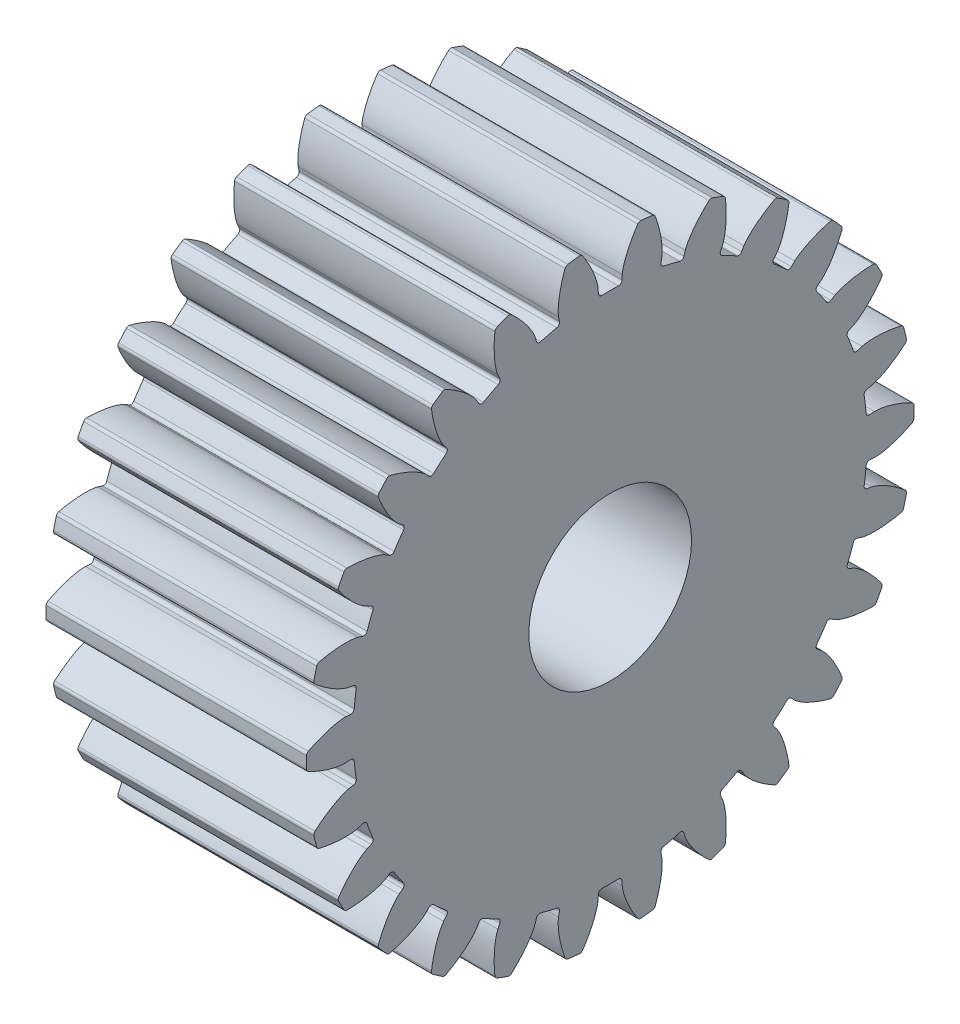
from build123d import *

# Parameters (mm, degrees)
SKETCH2_R                      = 14.816666667
SKETCH2_R_2                    = 3.96875
GEAR_WIDTH_EXTRUDE_DEPTH       = 12.7
GEAR_TOOTH_CUT_DEPTH           = 25.4
TOOTH_FILLETS_R                = 0.166158333
CIRPATTERN1_COUNT              = 26
CIRPATTERN1_COPY_1_DEPTH       = 25.4
CIRPATTERN1_COPY_2_DEPTH       = 25.4
CIRPATTERN1_COPY_3_DEPTH       = 25.4
CIRPATTERN1_COPY_4_DEPTH       = 25.4
CIRPATTERN1_COPY_5_DEPTH       = 25.4
CIRPATTERN1_COPY_6_DEPTH       = 25.4
CIRPATTERN1_COPY_7_DEPTH       = 25.4
CIRPATTERN1_COPY_8_DEPTH       = 25.4
CIRPATTERN1_COPY_9_DEPTH       = 25.4
CIRPATTERN1_COPY_10_DEPTH      = 25.4
CIRPATTERN1_COPY_11_DEPTH      = 25.4
CIRPATTERN1_COPY_12_DEPTH      = 25.4
CIRPATTERN1_COPY_13_DEPTH      = 25.4
CIRPATTERN1_COPY_14_DEPTH      = 25.4
CIRPATTERN1_COPY_15_DEPTH      = 25.4
CIRPATTERN1_COPY_16_DEPTH      = 25.4
CIRPATTERN1_COPY_17_DEPTH      = 25.4
CIRPATTERN1_COPY_18_DEPTH      = 25.4
CIRPATTERN1_COPY_19_DEPTH      = 25.4
CIRPATTERN1_COPY_20_DEPTH      = 25.4
CIRPATTERN1_COPY_21_DEPTH      = 25.4
CIRPATTERN1_COPY_22_DEPTH      = 25.4
CIRPATTERN1_COPY_23_DEPTH      = 25.4
CIRPATTERN1_COPY_24_DEPTH      = 25.4
CIRPATTERN1_COPY_25_DEPTH      = 25.4
TOOTH_FILLETS_OF_CIRPATTERN1_R = 0.166158333


with BuildPart() as part:
    # Sketch2 → Gear Width Extrude (new body)
    with BuildSketch(Plane.YZ):
        with Locations(Location((0, 0, 0), (0, 0, 270))):
            Circle(SKETCH2_R)
        with Locations(Location((0, 0, 0), (0, 0, 270))):
            Circle(SKETCH2_R_2, mode=Mode.SUBTRACT)
    extrude(amount=GEAR_WIDTH_EXTRUDE_DEPTH)

    # Sketch3 → Gear Tooth Cut (cut)
    with BuildSketch(Plane.YZ):
        with BuildLine():
            Line((12.533841667, 0), (14.816666667, 0))
            ThreePointArc((14.816666667, 0), (14.79996166, 0.70338182), (14.749884306, 1.405177589))
            add(Edge.make_bspline(
                [(12.915217508, 0.588188798), (12.918208341, 0.588360522), (12.926591, 0.5889519), (12.952440381, 0.591486174), (13.003294161, 0.598476616), (13.065845165, 0.609963216), (13.137508857, 0.625896967), (13.206422051, 0.64341803), (13.265177715, 0.659725839), (13.323624717, 0.677227502), (13.381691149, 0.695773656), (13.451831714, 0.719550719), (13.535655857, 0.749883796), (13.633192126, 0.787986968), (13.743267873, 0.834322472), (13.854828898, 0.884873112), (13.964077164, 0.937345481), (14.073810457, 0.993489939), (14.179521744, 1.050028375), (14.288612776, 1.111944092), (14.388950715, 1.17071875), (14.500534436, 1.240082235), (14.590344265, 1.297086613), (14.682395145, 1.358891943), (14.72708899, 1.389403312), (14.749884306, 1.405177589)],
                knots=[0, 0, 0, 0, 0, 0.005376749, 0.015083688, 0.04661014, 0.092110526, 0.119476176, 0.146842496, 0.174208854, 0.201574956, 0.228941013, 0.256307345, 0.307035032, 0.361767352, 0.416499661, 0.471231937, 0.525964282, 0.580696616, 0.635428982, 0.690161387, 0.744893688, 0.799626082, 0.854358407, 0.909090914, 0.909090914, 0.909090914, 0.909090914, 0.909090914], degree=4))
            Line((12.915217508, 0.588188798), (12.52086362, 0.570229012))
            ThreePointArc((12.52086362, 0.570229012), (12.530596735, 0.28518834), (12.533841667, 0))
        make_face()
    gear_tooth_cut = extrude(amount=GEAR_TOOTH_CUT_DEPTH, mode=Mode.SUBTRACT)

    # Gear Tooth Cut Mirror: Gear Tooth Cut across plane
    add(gear_tooth_cut.mirror(Plane(origin=(25.4, 0, 0), x_dir=(1, 0, 0), z_dir=(0, 0, 1))), mode=Mode.SUBTRACT)

    # Tooth Fillets
    tooth_fillets_edges = [part.edges().sort_by_distance(p)[0] for p in [
        (6.35, 14.749884306, 1.405177589),
        (6.35, 14.749884306, -1.405177589),
        (6.35, 12.52086362, 0.570229012),
        (6.35, 12.52086362, -0.570229012),
    ]]
    fillet(tooth_fillets_edges, radius=TOOTH_FILLETS_R)

    # CirPattern1: Gear Tooth Cut ×26 about axis
    cirpattern1_axis = Axis((0, 0, 0), (1, 0, 0))
    for i in range(1, CIRPATTERN1_COUNT):
        add(gear_tooth_cut.rotate(cirpattern1_axis, i * 360 / CIRPATTERN1_COUNT), mode=Mode.SUBTRACT)

    # CirPattern1 copy 1 sketch → CirPattern1 copy 1 (cut)
    with BuildSketch(Plane(origin=(0, 0, 0), x_dir=(0, 0.970941817426052, 0.23931566428755777), z_dir=(1, 0, 0))):
        with BuildLine():
            Line((12.533841667, 0), (14.816666667, 0))
            ThreePointArc((14.816666667, 0), (14.79996166, -0.70338182), (14.749884306, -1.405177589))
            add(Edge.make_bspline(
                [(12.915217508, -0.588188798), (12.918208341, -0.588360522), (12.926591, -0.5889519), (12.952440381, -0.591486174), (13.003294161, -0.598476616), (13.065845165, -0.609963216), (13.137508857, -0.625896967), (13.206422051, -0.64341803), (13.265177715, -0.659725839), (13.323624717, -0.677227502), (13.381691149, -0.695773656), (13.451831714, -0.719550719), (13.535655857, -0.749883796), (13.633192126, -0.787986968), (13.743267873, -0.834322472), (13.854828898, -0.884873112), (13.964077164, -0.937345481), (14.073810457, -0.993489939), (14.179521744, -1.050028375), (14.288612776, -1.111944092), (14.388950715, -1.17071875), (14.500534436, -1.240082235), (14.590344265, -1.297086613), (14.682395145, -1.358891943), (14.72708899, -1.389403312), (14.749884306, -1.405177589)],
                knots=[0, 0, 0, 0, 0, 0.005376749, 0.015083688, 0.04661014, 0.092110526, 0.119476176, 0.146842496, 0.174208854, 0.201574956, 0.228941013, 0.256307345, 0.307035032, 0.361767352, 0.416499661, 0.471231937, 0.525964282, 0.580696616, 0.635428982, 0.690161387, 0.744893688, 0.799626082, 0.854358407, 0.909090914, 0.909090914, 0.909090914, 0.909090914, 0.909090914], degree=4))
            Line((12.915217508, -0.588188798), (12.52086362, -0.570229012))
            ThreePointArc((12.52086362, -0.570229012), (12.530596735, -0.28518834), (12.533841667, 0))
        make_face()
    extrude(amount=CIRPATTERN1_COPY_1_DEPTH, mode=Mode.SUBTRACT)

    # CirPattern1 copy 2 sketch → CirPattern1 copy 2 (cut)
    with BuildSketch(Plane(origin=(0, 0, 0), x_dir=(0, 0.8854560256532099, 0.46472317204376856), z_dir=(1, 0, 0))):
        with BuildLine():
            Line((12.533841667, 0), (14.816666667, 0))
            ThreePointArc((14.816666667, 0), (14.79996166, -0.70338182), (14.749884306, -1.405177589))
            add(Edge.make_bspline(
                [(12.915217508, -0.588188798), (12.918208341, -0.588360522), (12.926591, -0.5889519), (12.952440381, -0.591486174), (13.003294161, -0.598476616), (13.065845165, -0.609963216), (13.137508857, -0.625896967), (13.206422051, -0.64341803), (13.265177715, -0.659725839), (13.323624717, -0.677227502), (13.381691149, -0.695773656), (13.451831714, -0.719550719), (13.535655857, -0.749883796), (13.633192126, -0.787986968), (13.743267873, -0.834322472), (13.854828898, -0.884873112), (13.964077164, -0.937345481), (14.073810457, -0.993489939), (14.179521744, -1.050028375), (14.288612776, -1.111944092), (14.388950715, -1.17071875), (14.500534436, -1.240082235), (14.590344265, -1.297086613), (14.682395145, -1.358891943), (14.72708899, -1.389403312), (14.749884306, -1.405177589)],
                knots=[0, 0, 0, 0, 0, 0.005376749, 0.015083688, 0.04661014, 0.092110526, 0.119476176, 0.146842496, 0.174208854, 0.201574956, 0.228941013, 0.256307345, 0.307035032, 0.361767352, 0.416499661, 0.471231937, 0.525964282, 0.580696616, 0.635428982, 0.690161387, 0.744893688, 0.799626082, 0.854358407, 0.909090914, 0.909090914, 0.909090914, 0.909090914, 0.909090914], degree=4))
            Line((12.915217508, -0.588188798), (12.52086362, -0.570229012))
            ThreePointArc((12.52086362, -0.570229012), (12.530596735, -0.28518834), (12.533841667, 0))
        make_face()
    extrude(amount=CIRPATTERN1_COPY_2_DEPTH, mode=Mode.SUBTRACT)

    # CirPattern1 copy 3 sketch → CirPattern1 copy 3 (cut)
    with BuildSketch(Plane(origin=(0, 0, 0), x_dir=(0, 0.7485107481711011, 0.6631226582407952), z_dir=(1, 0, 0))):
        with BuildLine():
            Line((12.533841667, 0), (14.816666667, 0))
            ThreePointArc((14.816666667, 0), (14.79996166, -0.70338182), (14.749884306, -1.405177589))
            add(Edge.make_bspline(
                [(12.915217508, -0.588188798), (12.918208341, -0.588360522), (12.926591, -0.5889519), (12.952440381, -0.591486174), (13.003294161, -0.598476616), (13.065845165, -0.609963216), (13.137508857, -0.625896967), (13.206422051, -0.64341803), (13.265177715, -0.659725839), (13.323624717, -0.677227502), (13.381691149, -0.695773656), (13.451831714, -0.719550719), (13.535655857, -0.749883796), (13.633192126, -0.787986968), (13.743267873, -0.834322472), (13.854828898, -0.884873112), (13.964077164, -0.937345481), (14.073810457, -0.993489939), (14.179521744, -1.050028375), (14.288612776, -1.111944092), (14.388950715, -1.17071875), (14.500534436, -1.240082235), (14.590344265, -1.297086613), (14.682395145, -1.358891943), (14.72708899, -1.389403312), (14.749884306, -1.405177589)],
                knots=[0, 0, 0, 0, 0, 0.005376749, 0.015083688, 0.04661014, 0.092110526, 0.119476176, 0.146842496, 0.174208854, 0.201574956, 0.228941013, 0.256307345, 0.307035032, 0.361767352, 0.416499661, 0.471231937, 0.525964282, 0.580696616, 0.635428982, 0.690161387, 0.744893688, 0.799626082, 0.854358407, 0.909090914, 0.909090914, 0.909090914, 0.909090914, 0.909090914], degree=4))
            Line((12.915217508, -0.588188798), (12.52086362, -0.570229012))
            ThreePointArc((12.52086362, -0.570229012), (12.530596735, -0.28518834), (12.533841667, 0))
        make_face()
    extrude(amount=CIRPATTERN1_COPY_3_DEPTH, mode=Mode.SUBTRACT)

    # CirPattern1 copy 4 sketch → CirPattern1 copy 4 (cut)
    with BuildSketch(Plane(origin=(0, 0, 0), x_dir=(0, 0.5680647467311558, 0.8229838658936565), z_dir=(1, 0, 0))):
        with BuildLine():
            Line((12.533841667, 0), (14.816666667, 0))
            ThreePointArc((14.816666667, 0), (14.79996166, -0.70338182), (14.749884306, -1.405177589))
            add(Edge.make_bspline(
                [(12.915217508, -0.588188798), (12.918208341, -0.588360522), (12.926591, -0.5889519), (12.952440381, -0.591486174), (13.003294161, -0.598476616), (13.065845165, -0.609963216), (13.137508857, -0.625896967), (13.206422051, -0.64341803), (13.265177715, -0.659725839), (13.323624717, -0.677227502), (13.381691149, -0.695773656), (13.451831714, -0.719550719), (13.535655857, -0.749883796), (13.633192126, -0.787986968), (13.743267873, -0.834322472), (13.854828898, -0.884873112), (13.964077164, -0.937345481), (14.073810457, -0.993489939), (14.179521744, -1.050028375), (14.288612776, -1.111944092), (14.388950715, -1.17071875), (14.500534436, -1.240082235), (14.590344265, -1.297086613), (14.682395145, -1.358891943), (14.72708899, -1.389403312), (14.749884306, -1.405177589)],
                knots=[0, 0, 0, 0, 0, 0.005376749, 0.015083688, 0.04661014, 0.092110526, 0.119476176, 0.146842496, 0.174208854, 0.201574956, 0.228941013, 0.256307345, 0.307035032, 0.361767352, 0.416499661, 0.471231937, 0.525964282, 0.580696616, 0.635428982, 0.690161387, 0.744893688, 0.799626082, 0.854358407, 0.909090914, 0.909090914, 0.909090914, 0.909090914, 0.909090914], degree=4))
            Line((12.915217508, -0.588188798), (12.52086362, -0.570229012))
            ThreePointArc((12.52086362, -0.570229012), (12.530596735, -0.28518834), (12.533841667, 0))
        make_face()
    extrude(amount=CIRPATTERN1_COPY_4_DEPTH, mode=Mode.SUBTRACT)

    # CirPattern1 copy 5 sketch → CirPattern1 copy 5 (cut)
    with BuildSketch(Plane(origin=(0, 0, 0), x_dir=(0, 0.3546048870425358, 0.9350162426854147), z_dir=(1, 0, 0))):
        with BuildLine():
            Line((12.533841667, 0), (14.816666667, 0))
            ThreePointArc((14.816666667, 0), (14.79996166, -0.70338182), (14.749884306, -1.405177589))
            add(Edge.make_bspline(
                [(12.915217508, -0.588188798), (12.918208341, -0.588360522), (12.926591, -0.5889519), (12.952440381, -0.591486174), (13.003294161, -0.598476616), (13.065845165, -0.609963216), (13.137508857, -0.625896967), (13.206422051, -0.64341803), (13.265177715, -0.659725839), (13.323624717, -0.677227502), (13.381691149, -0.695773656), (13.451831714, -0.719550719), (13.535655857, -0.749883796), (13.633192126, -0.787986968), (13.743267873, -0.834322472), (13.854828898, -0.884873112), (13.964077164, -0.937345481), (14.073810457, -0.993489939), (14.179521744, -1.050028375), (14.288612776, -1.111944092), (14.388950715, -1.17071875), (14.500534436, -1.240082235), (14.590344265, -1.297086613), (14.682395145, -1.358891943), (14.72708899, -1.389403312), (14.749884306, -1.405177589)],
                knots=[0, 0, 0, 0, 0, 0.005376749, 0.015083688, 0.04661014, 0.092110526, 0.119476176, 0.146842496, 0.174208854, 0.201574956, 0.228941013, 0.256307345, 0.307035032, 0.361767352, 0.416499661, 0.471231937, 0.525964282, 0.580696616, 0.635428982, 0.690161387, 0.744893688, 0.799626082, 0.854358407, 0.909090914, 0.909090914, 0.909090914, 0.909090914, 0.909090914], degree=4))
            Line((12.915217508, -0.588188798), (12.52086362, -0.570229012))
            ThreePointArc((12.52086362, -0.570229012), (12.530596735, -0.28518834), (12.533841667, 0))
        make_face()
    extrude(amount=CIRPATTERN1_COPY_5_DEPTH, mode=Mode.SUBTRACT)

    # CirPattern1 copy 6 sketch → CirPattern1 copy 6 (cut)
    with BuildSketch(Plane(origin=(0, 0, 0), x_dir=(0, 0.120536680255323, 0.992708874098054), z_dir=(1, 0, 0))):
        with BuildLine():
            Line((12.533841667, 0), (14.816666667, 0))
            ThreePointArc((14.816666667, 0), (14.79996166, -0.70338182), (14.749884306, -1.405177589))
            add(Edge.make_bspline(
                [(12.915217508, -0.588188798), (12.918208341, -0.588360522), (12.926591, -0.5889519), (12.952440381, -0.591486174), (13.003294161, -0.598476616), (13.065845165, -0.609963216), (13.137508857, -0.625896967), (13.206422051, -0.64341803), (13.265177715, -0.659725839), (13.323624717, -0.677227502), (13.381691149, -0.695773656), (13.451831714, -0.719550719), (13.535655857, -0.749883796), (13.633192126, -0.787986968), (13.743267873, -0.834322472), (13.854828898, -0.884873112), (13.964077164, -0.937345481), (14.073810457, -0.993489939), (14.179521744, -1.050028375), (14.288612776, -1.111944092), (14.388950715, -1.17071875), (14.500534436, -1.240082235), (14.590344265, -1.297086613), (14.682395145, -1.358891943), (14.72708899, -1.389403312), (14.749884306, -1.405177589)],
                knots=[0, 0, 0, 0, 0, 0.005376749, 0.015083688, 0.04661014, 0.092110526, 0.119476176, 0.146842496, 0.174208854, 0.201574956, 0.228941013, 0.256307345, 0.307035032, 0.361767352, 0.416499661, 0.471231937, 0.525964282, 0.580696616, 0.635428982, 0.690161387, 0.744893688, 0.799626082, 0.854358407, 0.909090914, 0.909090914, 0.909090914, 0.909090914, 0.909090914], degree=4))
            Line((12.915217508, -0.588188798), (12.52086362, -0.570229012))
            ThreePointArc((12.52086362, -0.570229012), (12.530596735, -0.28518834), (12.533841667, 0))
        make_face()
    extrude(amount=CIRPATTERN1_COPY_6_DEPTH, mode=Mode.SUBTRACT)

    # CirPattern1 copy 7 sketch → CirPattern1 copy 7 (cut)
    with BuildSketch(Plane(origin=(0, 0, 0), x_dir=(0, -0.1205366802553231, 0.992708874098054), z_dir=(1, 0, 0))):
        with BuildLine():
            Line((12.533841667, 0), (14.816666667, 0))
            ThreePointArc((14.816666667, 0), (14.79996166, -0.70338182), (14.749884306, -1.405177589))
            add(Edge.make_bspline(
                [(12.915217508, -0.588188798), (12.918208341, -0.588360522), (12.926591, -0.5889519), (12.952440381, -0.591486174), (13.003294161, -0.598476616), (13.065845165, -0.609963216), (13.137508857, -0.625896967), (13.206422051, -0.64341803), (13.265177715, -0.659725839), (13.323624717, -0.677227502), (13.381691149, -0.695773656), (13.451831714, -0.719550719), (13.535655857, -0.749883796), (13.633192126, -0.787986968), (13.743267873, -0.834322472), (13.854828898, -0.884873112), (13.964077164, -0.937345481), (14.073810457, -0.993489939), (14.179521744, -1.050028375), (14.288612776, -1.111944092), (14.388950715, -1.17071875), (14.500534436, -1.240082235), (14.590344265, -1.297086613), (14.682395145, -1.358891943), (14.72708899, -1.389403312), (14.749884306, -1.405177589)],
                knots=[0, 0, 0, 0, 0, 0.005376749, 0.015083688, 0.04661014, 0.092110526, 0.119476176, 0.146842496, 0.174208854, 0.201574956, 0.228941013, 0.256307345, 0.307035032, 0.361767352, 0.416499661, 0.471231937, 0.525964282, 0.580696616, 0.635428982, 0.690161387, 0.744893688, 0.799626082, 0.854358407, 0.909090914, 0.909090914, 0.909090914, 0.909090914, 0.909090914], degree=4))
            Line((12.915217508, -0.588188798), (12.52086362, -0.570229012))
            ThreePointArc((12.52086362, -0.570229012), (12.530596735, -0.28518834), (12.533841667, 0))
        make_face()
    extrude(amount=CIRPATTERN1_COPY_7_DEPTH, mode=Mode.SUBTRACT)

    # CirPattern1 copy 8 sketch → CirPattern1 copy 8 (cut)
    with BuildSketch(Plane(origin=(0, 0, 0), x_dir=(0, -0.3546048870425357, 0.9350162426854148), z_dir=(1, 0, 0))):
        with BuildLine():
            Line((12.533841667, 0), (14.816666667, 0))
            ThreePointArc((14.816666667, 0), (14.79996166, -0.70338182), (14.749884306, -1.405177589))
            add(Edge.make_bspline(
                [(12.915217508, -0.588188798), (12.918208341, -0.588360522), (12.926591, -0.5889519), (12.952440381, -0.591486174), (13.003294161, -0.598476616), (13.065845165, -0.609963216), (13.137508857, -0.625896967), (13.206422051, -0.64341803), (13.265177715, -0.659725839), (13.323624717, -0.677227502), (13.381691149, -0.695773656), (13.451831714, -0.719550719), (13.535655857, -0.749883796), (13.633192126, -0.787986968), (13.743267873, -0.834322472), (13.854828898, -0.884873112), (13.964077164, -0.937345481), (14.073810457, -0.993489939), (14.179521744, -1.050028375), (14.288612776, -1.111944092), (14.388950715, -1.17071875), (14.500534436, -1.240082235), (14.590344265, -1.297086613), (14.682395145, -1.358891943), (14.72708899, -1.389403312), (14.749884306, -1.405177589)],
                knots=[0, 0, 0, 0, 0, 0.005376749, 0.015083688, 0.04661014, 0.092110526, 0.119476176, 0.146842496, 0.174208854, 0.201574956, 0.228941013, 0.256307345, 0.307035032, 0.361767352, 0.416499661, 0.471231937, 0.525964282, 0.580696616, 0.635428982, 0.690161387, 0.744893688, 0.799626082, 0.854358407, 0.909090914, 0.909090914, 0.909090914, 0.909090914, 0.909090914], degree=4))
            Line((12.915217508, -0.588188798), (12.52086362, -0.570229012))
            ThreePointArc((12.52086362, -0.570229012), (12.530596735, -0.28518834), (12.533841667, 0))
        make_face()
    extrude(amount=CIRPATTERN1_COPY_8_DEPTH, mode=Mode.SUBTRACT)

    # CirPattern1 copy 9 sketch → CirPattern1 copy 9 (cut)
    with BuildSketch(Plane(origin=(0, 0, 0), x_dir=(0, -0.5680647467311557, 0.8229838658936565), z_dir=(1, 0, 0))):
        with BuildLine():
            Line((12.533841667, 0), (14.816666667, 0))
            ThreePointArc((14.816666667, 0), (14.79996166, -0.70338182), (14.749884306, -1.405177589))
            add(Edge.make_bspline(
                [(12.915217508, -0.588188798), (12.918208341, -0.588360522), (12.926591, -0.5889519), (12.952440381, -0.591486174), (13.003294161, -0.598476616), (13.065845165, -0.609963216), (13.137508857, -0.625896967), (13.206422051, -0.64341803), (13.265177715, -0.659725839), (13.323624717, -0.677227502), (13.381691149, -0.695773656), (13.451831714, -0.719550719), (13.535655857, -0.749883796), (13.633192126, -0.787986968), (13.743267873, -0.834322472), (13.854828898, -0.884873112), (13.964077164, -0.937345481), (14.073810457, -0.993489939), (14.179521744, -1.050028375), (14.288612776, -1.111944092), (14.388950715, -1.17071875), (14.500534436, -1.240082235), (14.590344265, -1.297086613), (14.682395145, -1.358891943), (14.72708899, -1.389403312), (14.749884306, -1.405177589)],
                knots=[0, 0, 0, 0, 0, 0.005376749, 0.015083688, 0.04661014, 0.092110526, 0.119476176, 0.146842496, 0.174208854, 0.201574956, 0.228941013, 0.256307345, 0.307035032, 0.361767352, 0.416499661, 0.471231937, 0.525964282, 0.580696616, 0.635428982, 0.690161387, 0.744893688, 0.799626082, 0.854358407, 0.909090914, 0.909090914, 0.909090914, 0.909090914, 0.909090914], degree=4))
            Line((12.915217508, -0.588188798), (12.52086362, -0.570229012))
            ThreePointArc((12.52086362, -0.570229012), (12.530596735, -0.28518834), (12.533841667, 0))
        make_face()
    extrude(amount=CIRPATTERN1_COPY_9_DEPTH, mode=Mode.SUBTRACT)

    # CirPattern1 copy 10 sketch → CirPattern1 copy 10 (cut)
    with BuildSketch(Plane(origin=(0, 0, 0), x_dir=(0, -0.7485107481711009, 0.6631226582407955), z_dir=(1, 0, 0))):
        with BuildLine():
            Line((12.533841667, 0), (14.816666667, 0))
            ThreePointArc((14.816666667, 0), (14.79996166, -0.70338182), (14.749884306, -1.405177589))
            add(Edge.make_bspline(
                [(12.915217508, -0.588188798), (12.918208341, -0.588360522), (12.926591, -0.5889519), (12.952440381, -0.591486174), (13.003294161, -0.598476616), (13.065845165, -0.609963216), (13.137508857, -0.625896967), (13.206422051, -0.64341803), (13.265177715, -0.659725839), (13.323624717, -0.677227502), (13.381691149, -0.695773656), (13.451831714, -0.719550719), (13.535655857, -0.749883796), (13.633192126, -0.787986968), (13.743267873, -0.834322472), (13.854828898, -0.884873112), (13.964077164, -0.937345481), (14.073810457, -0.993489939), (14.179521744, -1.050028375), (14.288612776, -1.111944092), (14.388950715, -1.17071875), (14.500534436, -1.240082235), (14.590344265, -1.297086613), (14.682395145, -1.358891943), (14.72708899, -1.389403312), (14.749884306, -1.405177589)],
                knots=[0, 0, 0, 0, 0, 0.005376749, 0.015083688, 0.04661014, 0.092110526, 0.119476176, 0.146842496, 0.174208854, 0.201574956, 0.228941013, 0.256307345, 0.307035032, 0.361767352, 0.416499661, 0.471231937, 0.525964282, 0.580696616, 0.635428982, 0.690161387, 0.744893688, 0.799626082, 0.854358407, 0.909090914, 0.909090914, 0.909090914, 0.909090914, 0.909090914], degree=4))
            Line((12.915217508, -0.588188798), (12.52086362, -0.570229012))
            ThreePointArc((12.52086362, -0.570229012), (12.530596735, -0.28518834), (12.533841667, 0))
        make_face()
    extrude(amount=CIRPATTERN1_COPY_10_DEPTH, mode=Mode.SUBTRACT)

    # CirPattern1 copy 11 sketch → CirPattern1 copy 11 (cut)
    with BuildSketch(Plane(origin=(0, 0, 0), x_dir=(0, -0.88545602565321, 0.4647231720437683), z_dir=(1, 0, 0))):
        with BuildLine():
            Line((12.533841667, 0), (14.816666667, 0))
            ThreePointArc((14.816666667, 0), (14.79996166, -0.70338182), (14.749884306, -1.405177589))
            add(Edge.make_bspline(
                [(12.915217508, -0.588188798), (12.918208341, -0.588360522), (12.926591, -0.5889519), (12.952440381, -0.591486174), (13.003294161, -0.598476616), (13.065845165, -0.609963216), (13.137508857, -0.625896967), (13.206422051, -0.64341803), (13.265177715, -0.659725839), (13.323624717, -0.677227502), (13.381691149, -0.695773656), (13.451831714, -0.719550719), (13.535655857, -0.749883796), (13.633192126, -0.787986968), (13.743267873, -0.834322472), (13.854828898, -0.884873112), (13.964077164, -0.937345481), (14.073810457, -0.993489939), (14.179521744, -1.050028375), (14.288612776, -1.111944092), (14.388950715, -1.17071875), (14.500534436, -1.240082235), (14.590344265, -1.297086613), (14.682395145, -1.358891943), (14.72708899, -1.389403312), (14.749884306, -1.405177589)],
                knots=[0, 0, 0, 0, 0, 0.005376749, 0.015083688, 0.04661014, 0.092110526, 0.119476176, 0.146842496, 0.174208854, 0.201574956, 0.228941013, 0.256307345, 0.307035032, 0.361767352, 0.416499661, 0.471231937, 0.525964282, 0.580696616, 0.635428982, 0.690161387, 0.744893688, 0.799626082, 0.854358407, 0.909090914, 0.909090914, 0.909090914, 0.909090914, 0.909090914], degree=4))
            Line((12.915217508, -0.588188798), (12.52086362, -0.570229012))
            ThreePointArc((12.52086362, -0.570229012), (12.530596735, -0.28518834), (12.533841667, 0))
        make_face()
    extrude(amount=CIRPATTERN1_COPY_11_DEPTH, mode=Mode.SUBTRACT)

    # CirPattern1 copy 12 sketch → CirPattern1 copy 12 (cut)
    with BuildSketch(Plane(origin=(0, 0, 0), x_dir=(0, -0.970941817426052, 0.23931566428755768), z_dir=(1, 0, 0))):
        with BuildLine():
            Line((12.533841667, 0), (14.816666667, 0))
            ThreePointArc((14.816666667, 0), (14.79996166, -0.70338182), (14.749884306, -1.405177589))
            add(Edge.make_bspline(
                [(12.915217508, -0.588188798), (12.918208341, -0.588360522), (12.926591, -0.5889519), (12.952440381, -0.591486174), (13.003294161, -0.598476616), (13.065845165, -0.609963216), (13.137508857, -0.625896967), (13.206422051, -0.64341803), (13.265177715, -0.659725839), (13.323624717, -0.677227502), (13.381691149, -0.695773656), (13.451831714, -0.719550719), (13.535655857, -0.749883796), (13.633192126, -0.787986968), (13.743267873, -0.834322472), (13.854828898, -0.884873112), (13.964077164, -0.937345481), (14.073810457, -0.993489939), (14.179521744, -1.050028375), (14.288612776, -1.111944092), (14.388950715, -1.17071875), (14.500534436, -1.240082235), (14.590344265, -1.297086613), (14.682395145, -1.358891943), (14.72708899, -1.389403312), (14.749884306, -1.405177589)],
                knots=[0, 0, 0, 0, 0, 0.005376749, 0.015083688, 0.04661014, 0.092110526, 0.119476176, 0.146842496, 0.174208854, 0.201574956, 0.228941013, 0.256307345, 0.307035032, 0.361767352, 0.416499661, 0.471231937, 0.525964282, 0.580696616, 0.635428982, 0.690161387, 0.744893688, 0.799626082, 0.854358407, 0.909090914, 0.909090914, 0.909090914, 0.909090914, 0.909090914], degree=4))
            Line((12.915217508, -0.588188798), (12.52086362, -0.570229012))
            ThreePointArc((12.52086362, -0.570229012), (12.530596735, -0.28518834), (12.533841667, 0))
        make_face()
    extrude(amount=CIRPATTERN1_COPY_12_DEPTH, mode=Mode.SUBTRACT)

    # CirPattern1 copy 13 sketch → CirPattern1 copy 13 (cut)
    with BuildSketch(Plane(origin=(0, 0, 0), x_dir=(0, -1, 0), z_dir=(1, 0, 0))):
        with BuildLine():
            Line((12.533841667, 0), (14.816666667, 0))
            ThreePointArc((14.816666667, 0), (14.79996166, -0.70338182), (14.749884306, -1.405177589))
            add(Edge.make_bspline(
                [(12.915217508, -0.588188798), (12.918208341, -0.588360522), (12.926591, -0.5889519), (12.952440381, -0.591486174), (13.003294161, -0.598476616), (13.065845165, -0.609963216), (13.137508857, -0.625896967), (13.206422051, -0.64341803), (13.265177715, -0.659725839), (13.323624717, -0.677227502), (13.381691149, -0.695773656), (13.451831714, -0.719550719), (13.535655857, -0.749883796), (13.633192126, -0.787986968), (13.743267873, -0.834322472), (13.854828898, -0.884873112), (13.964077164, -0.937345481), (14.073810457, -0.993489939), (14.179521744, -1.050028375), (14.288612776, -1.111944092), (14.388950715, -1.17071875), (14.500534436, -1.240082235), (14.590344265, -1.297086613), (14.682395145, -1.358891943), (14.72708899, -1.389403312), (14.749884306, -1.405177589)],
                knots=[0, 0, 0, 0, 0, 0.005376749, 0.015083688, 0.04661014, 0.092110526, 0.119476176, 0.146842496, 0.174208854, 0.201574956, 0.228941013, 0.256307345, 0.307035032, 0.361767352, 0.416499661, 0.471231937, 0.525964282, 0.580696616, 0.635428982, 0.690161387, 0.744893688, 0.799626082, 0.854358407, 0.909090914, 0.909090914, 0.909090914, 0.909090914, 0.909090914], degree=4))
            Line((12.915217508, -0.588188798), (12.52086362, -0.570229012))
            ThreePointArc((12.52086362, -0.570229012), (12.530596735, -0.28518834), (12.533841667, 0))
        make_face()
    extrude(amount=CIRPATTERN1_COPY_13_DEPTH, mode=Mode.SUBTRACT)

    # CirPattern1 copy 14 sketch → CirPattern1 copy 14 (cut)
    with BuildSketch(Plane(origin=(0, 0, 0), x_dir=(0, -0.970941817426052, -0.23931566428755788), z_dir=(1, 0, 0))):
        with BuildLine():
            Line((12.533841667, 0), (14.816666667, 0))
            ThreePointArc((14.816666667, 0), (14.79996166, -0.70338182), (14.749884306, -1.405177589))
            add(Edge.make_bspline(
                [(12.915217508, -0.588188798), (12.918208341, -0.588360522), (12.926591, -0.5889519), (12.952440381, -0.591486174), (13.003294161, -0.598476616), (13.065845165, -0.609963216), (13.137508857, -0.625896967), (13.206422051, -0.64341803), (13.265177715, -0.659725839), (13.323624717, -0.677227502), (13.381691149, -0.695773656), (13.451831714, -0.719550719), (13.535655857, -0.749883796), (13.633192126, -0.787986968), (13.743267873, -0.834322472), (13.854828898, -0.884873112), (13.964077164, -0.937345481), (14.073810457, -0.993489939), (14.179521744, -1.050028375), (14.288612776, -1.111944092), (14.388950715, -1.17071875), (14.500534436, -1.240082235), (14.590344265, -1.297086613), (14.682395145, -1.358891943), (14.72708899, -1.389403312), (14.749884306, -1.405177589)],
                knots=[0, 0, 0, 0, 0, 0.005376749, 0.015083688, 0.04661014, 0.092110526, 0.119476176, 0.146842496, 0.174208854, 0.201574956, 0.228941013, 0.256307345, 0.307035032, 0.361767352, 0.416499661, 0.471231937, 0.525964282, 0.580696616, 0.635428982, 0.690161387, 0.744893688, 0.799626082, 0.854358407, 0.909090914, 0.909090914, 0.909090914, 0.909090914, 0.909090914], degree=4))
            Line((12.915217508, -0.588188798), (12.52086362, -0.570229012))
            ThreePointArc((12.52086362, -0.570229012), (12.530596735, -0.28518834), (12.533841667, 0))
        make_face()
    extrude(amount=CIRPATTERN1_COPY_14_DEPTH, mode=Mode.SUBTRACT)

    # CirPattern1 copy 15 sketch → CirPattern1 copy 15 (cut)
    with BuildSketch(Plane(origin=(0, 0, 0), x_dir=(0, -0.8854560256532097, -0.46472317204376884), z_dir=(1, 0, 0))):
        with BuildLine():
            Line((12.533841667, 0), (14.816666667, 0))
            ThreePointArc((14.816666667, 0), (14.79996166, -0.70338182), (14.749884306, -1.405177589))
            add(Edge.make_bspline(
                [(12.915217508, -0.588188798), (12.918208341, -0.588360522), (12.926591, -0.5889519), (12.952440381, -0.591486174), (13.003294161, -0.598476616), (13.065845165, -0.609963216), (13.137508857, -0.625896967), (13.206422051, -0.64341803), (13.265177715, -0.659725839), (13.323624717, -0.677227502), (13.381691149, -0.695773656), (13.451831714, -0.719550719), (13.535655857, -0.749883796), (13.633192126, -0.787986968), (13.743267873, -0.834322472), (13.854828898, -0.884873112), (13.964077164, -0.937345481), (14.073810457, -0.993489939), (14.179521744, -1.050028375), (14.288612776, -1.111944092), (14.388950715, -1.17071875), (14.500534436, -1.240082235), (14.590344265, -1.297086613), (14.682395145, -1.358891943), (14.72708899, -1.389403312), (14.749884306, -1.405177589)],
                knots=[0, 0, 0, 0, 0, 0.005376749, 0.015083688, 0.04661014, 0.092110526, 0.119476176, 0.146842496, 0.174208854, 0.201574956, 0.228941013, 0.256307345, 0.307035032, 0.361767352, 0.416499661, 0.471231937, 0.525964282, 0.580696616, 0.635428982, 0.690161387, 0.744893688, 0.799626082, 0.854358407, 0.909090914, 0.909090914, 0.909090914, 0.909090914, 0.909090914], degree=4))
            Line((12.915217508, -0.588188798), (12.52086362, -0.570229012))
            ThreePointArc((12.52086362, -0.570229012), (12.530596735, -0.28518834), (12.533841667, 0))
        make_face()
    extrude(amount=CIRPATTERN1_COPY_15_DEPTH, mode=Mode.SUBTRACT)

    # CirPattern1 copy 16 sketch → CirPattern1 copy 16 (cut)
    with BuildSketch(Plane(origin=(0, 0, 0), x_dir=(0, -0.748510748171101, -0.6631226582407953), z_dir=(1, 0, 0))):
        with BuildLine():
            Line((12.533841667, 0), (14.816666667, 0))
            ThreePointArc((14.816666667, 0), (14.79996166, -0.70338182), (14.749884306, -1.405177589))
            add(Edge.make_bspline(
                [(12.915217508, -0.588188798), (12.918208341, -0.588360522), (12.926591, -0.5889519), (12.952440381, -0.591486174), (13.003294161, -0.598476616), (13.065845165, -0.609963216), (13.137508857, -0.625896967), (13.206422051, -0.64341803), (13.265177715, -0.659725839), (13.323624717, -0.677227502), (13.381691149, -0.695773656), (13.451831714, -0.719550719), (13.535655857, -0.749883796), (13.633192126, -0.787986968), (13.743267873, -0.834322472), (13.854828898, -0.884873112), (13.964077164, -0.937345481), (14.073810457, -0.993489939), (14.179521744, -1.050028375), (14.288612776, -1.111944092), (14.388950715, -1.17071875), (14.500534436, -1.240082235), (14.590344265, -1.297086613), (14.682395145, -1.358891943), (14.72708899, -1.389403312), (14.749884306, -1.405177589)],
                knots=[0, 0, 0, 0, 0, 0.005376749, 0.015083688, 0.04661014, 0.092110526, 0.119476176, 0.146842496, 0.174208854, 0.201574956, 0.228941013, 0.256307345, 0.307035032, 0.361767352, 0.416499661, 0.471231937, 0.525964282, 0.580696616, 0.635428982, 0.690161387, 0.744893688, 0.799626082, 0.854358407, 0.909090914, 0.909090914, 0.909090914, 0.909090914, 0.909090914], degree=4))
            Line((12.915217508, -0.588188798), (12.52086362, -0.570229012))
            ThreePointArc((12.52086362, -0.570229012), (12.530596735, -0.28518834), (12.533841667, 0))
        make_face()
    extrude(amount=CIRPATTERN1_COPY_16_DEPTH, mode=Mode.SUBTRACT)

    # CirPattern1 copy 17 sketch → CirPattern1 copy 17 (cut)
    with BuildSketch(Plane(origin=(0, 0, 0), x_dir=(0, -0.5680647467311559, -0.8229838658936564), z_dir=(1, 0, 0))):
        with BuildLine():
            Line((12.533841667, 0), (14.816666667, 0))
            ThreePointArc((14.816666667, 0), (14.79996166, -0.70338182), (14.749884306, -1.405177589))
            add(Edge.make_bspline(
                [(12.915217508, -0.588188798), (12.918208341, -0.588360522), (12.926591, -0.5889519), (12.952440381, -0.591486174), (13.003294161, -0.598476616), (13.065845165, -0.609963216), (13.137508857, -0.625896967), (13.206422051, -0.64341803), (13.265177715, -0.659725839), (13.323624717, -0.677227502), (13.381691149, -0.695773656), (13.451831714, -0.719550719), (13.535655857, -0.749883796), (13.633192126, -0.787986968), (13.743267873, -0.834322472), (13.854828898, -0.884873112), (13.964077164, -0.937345481), (14.073810457, -0.993489939), (14.179521744, -1.050028375), (14.288612776, -1.111944092), (14.388950715, -1.17071875), (14.500534436, -1.240082235), (14.590344265, -1.297086613), (14.682395145, -1.358891943), (14.72708899, -1.389403312), (14.749884306, -1.405177589)],
                knots=[0, 0, 0, 0, 0, 0.005376749, 0.015083688, 0.04661014, 0.092110526, 0.119476176, 0.146842496, 0.174208854, 0.201574956, 0.228941013, 0.256307345, 0.307035032, 0.361767352, 0.416499661, 0.471231937, 0.525964282, 0.580696616, 0.635428982, 0.690161387, 0.744893688, 0.799626082, 0.854358407, 0.909090914, 0.909090914, 0.909090914, 0.909090914, 0.909090914], degree=4))
            Line((12.915217508, -0.588188798), (12.52086362, -0.570229012))
            ThreePointArc((12.52086362, -0.570229012), (12.530596735, -0.28518834), (12.533841667, 0))
        make_face()
    extrude(amount=CIRPATTERN1_COPY_17_DEPTH, mode=Mode.SUBTRACT)

    # CirPattern1 copy 18 sketch → CirPattern1 copy 18 (cut)
    with BuildSketch(Plane(origin=(0, 0, 0), x_dir=(0, -0.3546048870425359, -0.9350162426854147), z_dir=(1, 0, 0))):
        with BuildLine():
            Line((12.533841667, 0), (14.816666667, 0))
            ThreePointArc((14.816666667, 0), (14.79996166, -0.70338182), (14.749884306, -1.405177589))
            add(Edge.make_bspline(
                [(12.915217508, -0.588188798), (12.918208341, -0.588360522), (12.926591, -0.5889519), (12.952440381, -0.591486174), (13.003294161, -0.598476616), (13.065845165, -0.609963216), (13.137508857, -0.625896967), (13.206422051, -0.64341803), (13.265177715, -0.659725839), (13.323624717, -0.677227502), (13.381691149, -0.695773656), (13.451831714, -0.719550719), (13.535655857, -0.749883796), (13.633192126, -0.787986968), (13.743267873, -0.834322472), (13.854828898, -0.884873112), (13.964077164, -0.937345481), (14.073810457, -0.993489939), (14.179521744, -1.050028375), (14.288612776, -1.111944092), (14.388950715, -1.17071875), (14.500534436, -1.240082235), (14.590344265, -1.297086613), (14.682395145, -1.358891943), (14.72708899, -1.389403312), (14.749884306, -1.405177589)],
                knots=[0, 0, 0, 0, 0, 0.005376749, 0.015083688, 0.04661014, 0.092110526, 0.119476176, 0.146842496, 0.174208854, 0.201574956, 0.228941013, 0.256307345, 0.307035032, 0.361767352, 0.416499661, 0.471231937, 0.525964282, 0.580696616, 0.635428982, 0.690161387, 0.744893688, 0.799626082, 0.854358407, 0.909090914, 0.909090914, 0.909090914, 0.909090914, 0.909090914], degree=4))
            Line((12.915217508, -0.588188798), (12.52086362, -0.570229012))
            ThreePointArc((12.52086362, -0.570229012), (12.530596735, -0.28518834), (12.533841667, 0))
        make_face()
    extrude(amount=CIRPATTERN1_COPY_18_DEPTH, mode=Mode.SUBTRACT)

    # CirPattern1 copy 19 sketch → CirPattern1 copy 19 (cut)
    with BuildSketch(Plane(origin=(0, 0, 0), x_dir=(0, -0.12053668025532269, -0.9927088740980541), z_dir=(1, 0, 0))):
        with BuildLine():
            Line((12.533841667, 0), (14.816666667, 0))
            ThreePointArc((14.816666667, 0), (14.79996166, -0.70338182), (14.749884306, -1.405177589))
            add(Edge.make_bspline(
                [(12.915217508, -0.588188798), (12.918208341, -0.588360522), (12.926591, -0.5889519), (12.952440381, -0.591486174), (13.003294161, -0.598476616), (13.065845165, -0.609963216), (13.137508857, -0.625896967), (13.206422051, -0.64341803), (13.265177715, -0.659725839), (13.323624717, -0.677227502), (13.381691149, -0.695773656), (13.451831714, -0.719550719), (13.535655857, -0.749883796), (13.633192126, -0.787986968), (13.743267873, -0.834322472), (13.854828898, -0.884873112), (13.964077164, -0.937345481), (14.073810457, -0.993489939), (14.179521744, -1.050028375), (14.288612776, -1.111944092), (14.388950715, -1.17071875), (14.500534436, -1.240082235), (14.590344265, -1.297086613), (14.682395145, -1.358891943), (14.72708899, -1.389403312), (14.749884306, -1.405177589)],
                knots=[0, 0, 0, 0, 0, 0.005376749, 0.015083688, 0.04661014, 0.092110526, 0.119476176, 0.146842496, 0.174208854, 0.201574956, 0.228941013, 0.256307345, 0.307035032, 0.361767352, 0.416499661, 0.471231937, 0.525964282, 0.580696616, 0.635428982, 0.690161387, 0.744893688, 0.799626082, 0.854358407, 0.909090914, 0.909090914, 0.909090914, 0.909090914, 0.909090914], degree=4))
            Line((12.915217508, -0.588188798), (12.52086362, -0.570229012))
            ThreePointArc((12.52086362, -0.570229012), (12.530596735, -0.28518834), (12.533841667, 0))
        make_face()
    extrude(amount=CIRPATTERN1_COPY_19_DEPTH, mode=Mode.SUBTRACT)

    # CirPattern1 copy 20 sketch → CirPattern1 copy 20 (cut)
    with BuildSketch(Plane(origin=(0, 0, 0), x_dir=(0, 0.12053668025532233, -0.9927088740980541), z_dir=(1, 0, 0))):
        with BuildLine():
            Line((12.533841667, 0), (14.816666667, 0))
            ThreePointArc((14.816666667, 0), (14.79996166, -0.70338182), (14.749884306, -1.405177589))
            add(Edge.make_bspline(
                [(12.915217508, -0.588188798), (12.918208341, -0.588360522), (12.926591, -0.5889519), (12.952440381, -0.591486174), (13.003294161, -0.598476616), (13.065845165, -0.609963216), (13.137508857, -0.625896967), (13.206422051, -0.64341803), (13.265177715, -0.659725839), (13.323624717, -0.677227502), (13.381691149, -0.695773656), (13.451831714, -0.719550719), (13.535655857, -0.749883796), (13.633192126, -0.787986968), (13.743267873, -0.834322472), (13.854828898, -0.884873112), (13.964077164, -0.937345481), (14.073810457, -0.993489939), (14.179521744, -1.050028375), (14.288612776, -1.111944092), (14.388950715, -1.17071875), (14.500534436, -1.240082235), (14.590344265, -1.297086613), (14.682395145, -1.358891943), (14.72708899, -1.389403312), (14.749884306, -1.405177589)],
                knots=[0, 0, 0, 0, 0, 0.005376749, 0.015083688, 0.04661014, 0.092110526, 0.119476176, 0.146842496, 0.174208854, 0.201574956, 0.228941013, 0.256307345, 0.307035032, 0.361767352, 0.416499661, 0.471231937, 0.525964282, 0.580696616, 0.635428982, 0.690161387, 0.744893688, 0.799626082, 0.854358407, 0.909090914, 0.909090914, 0.909090914, 0.909090914, 0.909090914], degree=4))
            Line((12.915217508, -0.588188798), (12.52086362, -0.570229012))
            ThreePointArc((12.52086362, -0.570229012), (12.530596735, -0.28518834), (12.533841667, 0))
        make_face()
    extrude(amount=CIRPATTERN1_COPY_20_DEPTH, mode=Mode.SUBTRACT)

    # CirPattern1 copy 21 sketch → CirPattern1 copy 21 (cut)
    with BuildSketch(Plane(origin=(0, 0, 0), x_dir=(0, 0.35460488704253557, -0.9350162426854148), z_dir=(1, 0, 0))):
        with BuildLine():
            Line((12.533841667, 0), (14.816666667, 0))
            ThreePointArc((14.816666667, 0), (14.79996166, -0.70338182), (14.749884306, -1.405177589))
            add(Edge.make_bspline(
                [(12.915217508, -0.588188798), (12.918208341, -0.588360522), (12.926591, -0.5889519), (12.952440381, -0.591486174), (13.003294161, -0.598476616), (13.065845165, -0.609963216), (13.137508857, -0.625896967), (13.206422051, -0.64341803), (13.265177715, -0.659725839), (13.323624717, -0.677227502), (13.381691149, -0.695773656), (13.451831714, -0.719550719), (13.535655857, -0.749883796), (13.633192126, -0.787986968), (13.743267873, -0.834322472), (13.854828898, -0.884873112), (13.964077164, -0.937345481), (14.073810457, -0.993489939), (14.179521744, -1.050028375), (14.288612776, -1.111944092), (14.388950715, -1.17071875), (14.500534436, -1.240082235), (14.590344265, -1.297086613), (14.682395145, -1.358891943), (14.72708899, -1.389403312), (14.749884306, -1.405177589)],
                knots=[0, 0, 0, 0, 0, 0.005376749, 0.015083688, 0.04661014, 0.092110526, 0.119476176, 0.146842496, 0.174208854, 0.201574956, 0.228941013, 0.256307345, 0.307035032, 0.361767352, 0.416499661, 0.471231937, 0.525964282, 0.580696616, 0.635428982, 0.690161387, 0.744893688, 0.799626082, 0.854358407, 0.909090914, 0.909090914, 0.909090914, 0.909090914, 0.909090914], degree=4))
            Line((12.915217508, -0.588188798), (12.52086362, -0.570229012))
            ThreePointArc((12.52086362, -0.570229012), (12.530596735, -0.28518834), (12.533841667, 0))
        make_face()
    extrude(amount=CIRPATTERN1_COPY_21_DEPTH, mode=Mode.SUBTRACT)

    # CirPattern1 copy 22 sketch → CirPattern1 copy 22 (cut)
    with BuildSketch(Plane(origin=(0, 0, 0), x_dir=(0, 0.5680647467311563, -0.822983865893656), z_dir=(1, 0, 0))):
        with BuildLine():
            Line((12.533841667, 0), (14.816666667, 0))
            ThreePointArc((14.816666667, 0), (14.79996166, -0.70338182), (14.749884306, -1.405177589))
            add(Edge.make_bspline(
                [(12.915217508, -0.588188798), (12.918208341, -0.588360522), (12.926591, -0.5889519), (12.952440381, -0.591486174), (13.003294161, -0.598476616), (13.065845165, -0.609963216), (13.137508857, -0.625896967), (13.206422051, -0.64341803), (13.265177715, -0.659725839), (13.323624717, -0.677227502), (13.381691149, -0.695773656), (13.451831714, -0.719550719), (13.535655857, -0.749883796), (13.633192126, -0.787986968), (13.743267873, -0.834322472), (13.854828898, -0.884873112), (13.964077164, -0.937345481), (14.073810457, -0.993489939), (14.179521744, -1.050028375), (14.288612776, -1.111944092), (14.388950715, -1.17071875), (14.500534436, -1.240082235), (14.590344265, -1.297086613), (14.682395145, -1.358891943), (14.72708899, -1.389403312), (14.749884306, -1.405177589)],
                knots=[0, 0, 0, 0, 0, 0.005376749, 0.015083688, 0.04661014, 0.092110526, 0.119476176, 0.146842496, 0.174208854, 0.201574956, 0.228941013, 0.256307345, 0.307035032, 0.361767352, 0.416499661, 0.471231937, 0.525964282, 0.580696616, 0.635428982, 0.690161387, 0.744893688, 0.799626082, 0.854358407, 0.909090914, 0.909090914, 0.909090914, 0.909090914, 0.909090914], degree=4))
            Line((12.915217508, -0.588188798), (12.52086362, -0.570229012))
            ThreePointArc((12.52086362, -0.570229012), (12.530596735, -0.28518834), (12.533841667, 0))
        make_face()
    extrude(amount=CIRPATTERN1_COPY_22_DEPTH, mode=Mode.SUBTRACT)

    # CirPattern1 copy 23 sketch → CirPattern1 copy 23 (cut)
    with BuildSketch(Plane(origin=(0, 0, 0), x_dir=(0, 0.7485107481711007, -0.6631226582407955), z_dir=(1, 0, 0))):
        with BuildLine():
            Line((12.533841667, 0), (14.816666667, 0))
            ThreePointArc((14.816666667, 0), (14.79996166, -0.70338182), (14.749884306, -1.405177589))
            add(Edge.make_bspline(
                [(12.915217508, -0.588188798), (12.918208341, -0.588360522), (12.926591, -0.5889519), (12.952440381, -0.591486174), (13.003294161, -0.598476616), (13.065845165, -0.609963216), (13.137508857, -0.625896967), (13.206422051, -0.64341803), (13.265177715, -0.659725839), (13.323624717, -0.677227502), (13.381691149, -0.695773656), (13.451831714, -0.719550719), (13.535655857, -0.749883796), (13.633192126, -0.787986968), (13.743267873, -0.834322472), (13.854828898, -0.884873112), (13.964077164, -0.937345481), (14.073810457, -0.993489939), (14.179521744, -1.050028375), (14.288612776, -1.111944092), (14.388950715, -1.17071875), (14.500534436, -1.240082235), (14.590344265, -1.297086613), (14.682395145, -1.358891943), (14.72708899, -1.389403312), (14.749884306, -1.405177589)],
                knots=[0, 0, 0, 0, 0, 0.005376749, 0.015083688, 0.04661014, 0.092110526, 0.119476176, 0.146842496, 0.174208854, 0.201574956, 0.228941013, 0.256307345, 0.307035032, 0.361767352, 0.416499661, 0.471231937, 0.525964282, 0.580696616, 0.635428982, 0.690161387, 0.744893688, 0.799626082, 0.854358407, 0.909090914, 0.909090914, 0.909090914, 0.909090914, 0.909090914], degree=4))
            Line((12.915217508, -0.588188798), (12.52086362, -0.570229012))
            ThreePointArc((12.52086362, -0.570229012), (12.530596735, -0.28518834), (12.533841667, 0))
        make_face()
    extrude(amount=CIRPATTERN1_COPY_23_DEPTH, mode=Mode.SUBTRACT)

    # CirPattern1 copy 24 sketch → CirPattern1 copy 24 (cut)
    with BuildSketch(Plane(origin=(0, 0, 0), x_dir=(0, 0.88545602565321, -0.4647231720437684), z_dir=(1, 0, 0))):
        with BuildLine():
            Line((12.533841667, 0), (14.816666667, 0))
            ThreePointArc((14.816666667, 0), (14.79996166, -0.70338182), (14.749884306, -1.405177589))
            add(Edge.make_bspline(
                [(12.915217508, -0.588188798), (12.918208341, -0.588360522), (12.926591, -0.5889519), (12.952440381, -0.591486174), (13.003294161, -0.598476616), (13.065845165, -0.609963216), (13.137508857, -0.625896967), (13.206422051, -0.64341803), (13.265177715, -0.659725839), (13.323624717, -0.677227502), (13.381691149, -0.695773656), (13.451831714, -0.719550719), (13.535655857, -0.749883796), (13.633192126, -0.787986968), (13.743267873, -0.834322472), (13.854828898, -0.884873112), (13.964077164, -0.937345481), (14.073810457, -0.993489939), (14.179521744, -1.050028375), (14.288612776, -1.111944092), (14.388950715, -1.17071875), (14.500534436, -1.240082235), (14.590344265, -1.297086613), (14.682395145, -1.358891943), (14.72708899, -1.389403312), (14.749884306, -1.405177589)],
                knots=[0, 0, 0, 0, 0, 0.005376749, 0.015083688, 0.04661014, 0.092110526, 0.119476176, 0.146842496, 0.174208854, 0.201574956, 0.228941013, 0.256307345, 0.307035032, 0.361767352, 0.416499661, 0.471231937, 0.525964282, 0.580696616, 0.635428982, 0.690161387, 0.744893688, 0.799626082, 0.854358407, 0.909090914, 0.909090914, 0.909090914, 0.909090914, 0.909090914], degree=4))
            Line((12.915217508, -0.588188798), (12.52086362, -0.570229012))
            ThreePointArc((12.52086362, -0.570229012), (12.530596735, -0.28518834), (12.533841667, 0))
        make_face()
    extrude(amount=CIRPATTERN1_COPY_24_DEPTH, mode=Mode.SUBTRACT)

    # CirPattern1 copy 25 sketch → CirPattern1 copy 25 (cut)
    with BuildSketch(Plane(origin=(0, 0, 0), x_dir=(0, 0.9709418174260522, -0.23931566428755693), z_dir=(1, 0, 0))):
        with BuildLine():
            Line((12.533841667, 0), (14.816666667, 0))
            ThreePointArc((14.816666667, 0), (14.79996166, -0.70338182), (14.749884306, -1.405177589))
            add(Edge.make_bspline(
                [(12.915217508, -0.588188798), (12.918208341, -0.588360522), (12.926591, -0.5889519), (12.952440381, -0.591486174), (13.003294161, -0.598476616), (13.065845165, -0.609963216), (13.137508857, -0.625896967), (13.206422051, -0.64341803), (13.265177715, -0.659725839), (13.323624717, -0.677227502), (13.381691149, -0.695773656), (13.451831714, -0.719550719), (13.535655857, -0.749883796), (13.633192126, -0.787986968), (13.743267873, -0.834322472), (13.854828898, -0.884873112), (13.964077164, -0.937345481), (14.073810457, -0.993489939), (14.179521744, -1.050028375), (14.288612776, -1.111944092), (14.388950715, -1.17071875), (14.500534436, -1.240082235), (14.590344265, -1.297086613), (14.682395145, -1.358891943), (14.72708899, -1.389403312), (14.749884306, -1.405177589)],
                knots=[0, 0, 0, 0, 0, 0.005376749, 0.015083688, 0.04661014, 0.092110526, 0.119476176, 0.146842496, 0.174208854, 0.201574956, 0.228941013, 0.256307345, 0.307035032, 0.361767352, 0.416499661, 0.471231937, 0.525964282, 0.580696616, 0.635428982, 0.690161387, 0.744893688, 0.799626082, 0.854358407, 0.909090914, 0.909090914, 0.909090914, 0.909090914, 0.909090914], degree=4))
            Line((12.915217508, -0.588188798), (12.52086362, -0.570229012))
            ThreePointArc((12.52086362, -0.570229012), (12.530596735, -0.28518834), (12.533841667, 0))
        make_face()
    extrude(amount=CIRPATTERN1_COPY_25_DEPTH, mode=Mode.SUBTRACT)

    # Tooth Fillets of CirPattern1
    tooth_fillets_of_cirpattern1_edges = [part.edges().sort_by_distance(p)[0] for p in [
        (6.35, 13.984998467, 4.894224043),
        (6.35, 14.657560484, 2.165532679),
        (6.35, 12.020565344, 3.550097988),
        (6.35, 12.293494814, 2.442779601),
        (6.35, 12.40735535, 8.098835986),
        (6.35, 13.713392523, 5.610390059),
        (6.35, 10.821675504, 6.323648173),
        (6.35, 11.351672774, 5.313822743),
        (6.35, 10.10864184, 10.832773019),
        (6.35, 11.972252036, 8.729191962),
        (6.35, 8.993869218, 8.729690912),
        (6.35, 9.750132775, 7.876045823),
        (6.35, 7.222450808, 12.937148659),
        (6.35, 9.535327777, 11.340684957),
        (6.35, 6.643371944, 10.628395746),
        (6.35, 7.581950498, 9.980541747),
        (6.35, 3.916517189, 14.289664245),
        (6.35, 6.544244928, 13.293098564),
        (6.35, 3.906786041, 11.909416852),
        (6.35, 4.973132818, 11.505004863),
        (6.35, 0.382969826, 14.811716485),
        (6.35, 3.172834351, 14.472965601),
        (6.35, 0.943151934, 12.498305939),
        (6.35, 2.075294736, 12.360838915),
        (6.35, -3.172834351, 14.472965601),
        (6.35, -0.382969826, 14.811716485),
        (6.35, -2.075294736, 12.360838915),
        (6.35, -0.943151934, 12.498305939),
        (6.35, -6.544244928, 13.293098564),
        (6.35, -3.916517189, 14.289664245),
        (6.35, -4.973132818, 11.505004863),
        (6.35, -3.906786041, 11.909416852),
        (6.35, -9.535327777, 11.340684957),
        (6.35, -7.222450808, 12.937148659),
        (6.35, -7.581950498, 9.980541747),
        (6.35, -6.643371944, 10.628395746),
        (6.35, -11.972252036, 8.729191962),
        (6.35, -10.10864184, 10.832773019),
        (6.35, -9.750132775, 7.876045823),
        (6.35, -8.993869218, 8.729690912),
        (6.35, -13.713392523, 5.610390059),
        (6.35, -12.40735535, 8.098835986),
        (6.35, -11.351672774, 5.313822743),
        (6.35, -10.821675504, 6.323648173),
        (6.35, -14.657560484, 2.165532679),
        (6.35, -13.984998467, 4.894224043),
        (6.35, -12.293494814, 2.442779601),
        (6.35, -12.020565344, 3.550097988),
        (6.35, -14.749884306, -1.405177589),
        (6.35, -14.749884306, 1.405177589),
        (6.35, -12.52086362, -0.570229012),
        (6.35, -12.52086362, 0.570229012),
        (6.35, -13.984998467, -4.894224043),
        (6.35, -14.657560484, -2.165532679),
        (6.35, -12.020565344, -3.550097988),
        (6.35, -12.293494814, -2.442779601),
        (6.35, -12.40735535, -8.098835986),
        (6.35, -13.713392523, -5.610390059),
        (6.35, -10.821675504, -6.323648173),
        (6.35, -11.351672774, -5.313822743),
        (6.35, -10.10864184, -10.832773019),
        (6.35, -11.972252036, -8.729191962),
        (6.35, -8.993869218, -8.729690912),
        (6.35, -9.750132775, -7.876045823),
        (6.35, -7.222450808, -12.937148659),
        (6.35, -9.535327777, -11.340684957),
        (6.35, -6.643371944, -10.628395746),
        (6.35, -7.581950498, -9.980541747),
        (6.35, -3.916517189, -14.289664245),
        (6.35, -6.544244928, -13.293098564),
        (6.35, -3.906786041, -11.909416852),
        (6.35, -4.973132818, -11.505004863),
        (6.35, -0.382969826, -14.811716485),
        (6.35, -3.172834351, -14.472965601),
        (6.35, -0.943151934, -12.498305939),
        (6.35, -2.075294736, -12.360838915),
        (6.35, 3.172834351, -14.472965601),
        (6.35, 0.382969826, -14.811716485),
        (6.35, 2.075294736, -12.360838915),
        (6.35, 0.943151934, -12.498305939),
        (6.35, 6.544244928, -13.293098564),
        (6.35, 3.916517189, -14.289664245),
        (6.35, 4.973132818, -11.505004863),
        (6.35, 3.906786041, -11.909416852),
        (6.35, 9.535327777, -11.340684957),
        (6.35, 7.222450808, -12.937148659),
        (6.35, 7.581950498, -9.980541747),
        (6.35, 6.643371944, -10.628395746),
        (6.35, 11.972252036, -8.729191962),
        (6.35, 10.10864184, -10.832773019),
        (6.35, 9.750132775, -7.876045823),
        (6.35, 8.993869218, -8.729690912),
        (6.35, 13.713392523, -5.610390059),
        (6.35, 12.40735535, -8.098835986),
        (6.35, 11.351672774, -5.313822743),
        (6.35, 10.821675504, -6.323648173),
        (6.35, 14.657560484, -2.165532679),
        (6.35, 13.984998467, -4.894224043),
        (6.35, 12.293494814, -2.442779601),
        (6.35, 12.020565344, -3.550097988),
    ]]
    fillet(tooth_fillets_of_cirpattern1_edges, radius=TOOTH_FILLETS_OF_CIRPATTERN1_R)


solid = part.part
